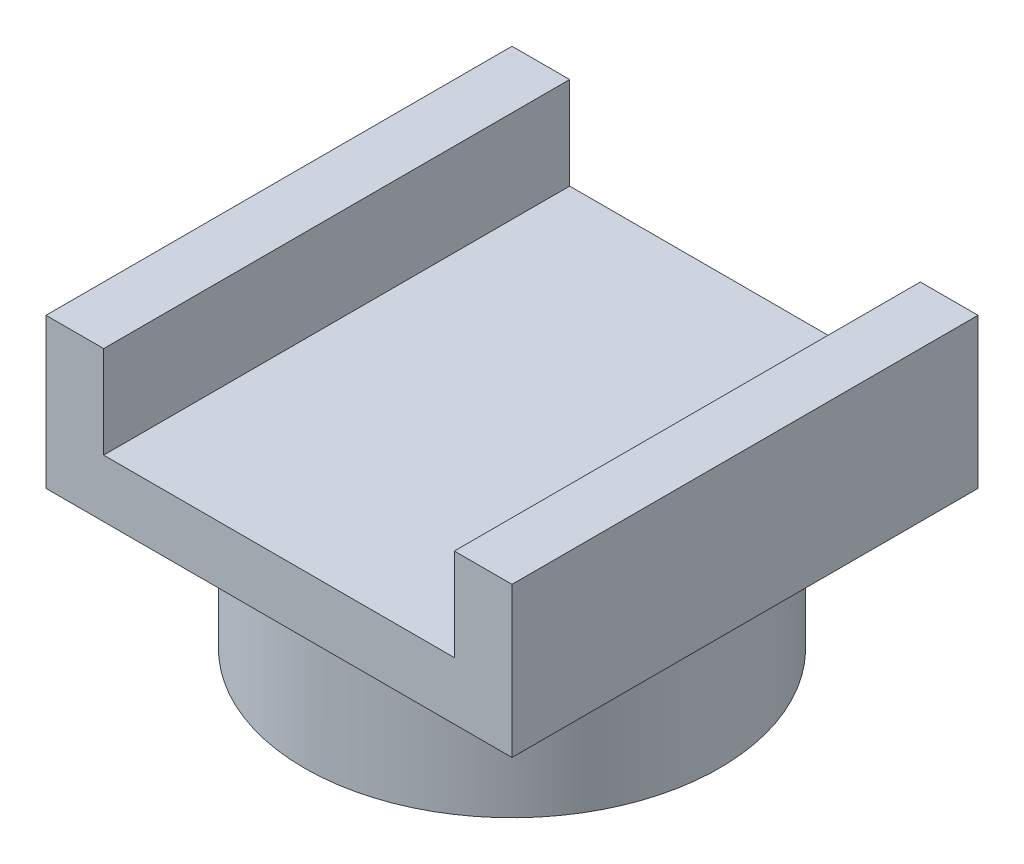
from build123d import *

# Parameters (mm, degrees)
SKETCH1_R           = 0.5
SKETCH1_R_2         = 1.375
BOSS_EXTRUDE1_DEPTH = 2
SKETCH4_R           = 4.5
SKETCH4_R_2         = 2.5
BOSS_EXTRUDE3_DEPTH = 3
CUT_EXTRUDE3_START  = -3
CUT_EXTRUDE3_DEPTH  = 3
SKETCH6_W           = 34.029642768
SKETCH6_H           = 33.796563024
CUT_EXTRUDE4_DEPTH  = 22.43595111
SKETCH7_W           = 10.1
SKETCH7_H           = 10.1
BOSS_EXTRUDE4_DEPTH = 1.25
SKETCH8_W           = 1.25
SKETCH8_H           = 10.1
BOSS_EXTRUDE5_DEPTH = 2


with BuildPart() as part:
    # Sketch1 → Boss-Extrude1 (new body)
    with BuildSketch(Plane(origin=(0, 0, 0), x_dir=(1, 0, 0), z_dir=(0, 1, 0))):
        with BuildLine():
            Line((-4, 4), (-2.467435953, 13.402193757))
            ThreePointArc((-2.467435953, 13.402193757), (0, 15.5), (2.467435953, 13.402193757))
            Line((2.467435953, 13.402193757), (4, 4))
            Line((4, 4), (12.448472752, 2.459445505))
            ThreePointArc((12.448472752, 2.459445505), (14.5, 0), (12.448472752, -2.459445505))
            Line((12.448472752, -2.459445505), (4, -4))
            Line((4, -4), (2.467435953, -13.402193757))
            ThreePointArc((2.467435953, -13.402193757), (0, -15.5), (-2.467435953, -13.402193757))
            Line((-2.467435953, -13.402193757), (-4, -4))
            Line((-4, -4), (-12.448472752, -2.459445505))
            ThreePointArc((-12.448472752, -2.459445505), (-14.5, 0), (-12.448472752, 2.459445505))
            Line((-12.448472752, 2.459445505), (-4, 4))
        make_face()
        with Locations(Location((0, 12, 0), (0, 0, 270))):
            Circle(SKETCH1_R, mode=Mode.SUBTRACT)
        with Locations(Location((0, 9.5, 0), (0, 0, 270))):
            Circle(SKETCH1_R, mode=Mode.SUBTRACT)
        with Locations(Location((0, 7.5, 0), (0, 0, 270))):
            Circle(SKETCH1_R, mode=Mode.SUBTRACT)
        with Locations(Location((12, 0, 0), (0, 0, 270))):
            Circle(SKETCH1_R, mode=Mode.SUBTRACT)
        with Locations(Location((9.5, 0, 0), (0, 0, 270))):
            Circle(SKETCH1_R, mode=Mode.SUBTRACT)
        with Locations(Location((7.5, 0, 0), (0, 0, 270))):
            Circle(SKETCH1_R, mode=Mode.SUBTRACT)
        with Locations(Location((0, -12, 0), (0, 0, 270))):
            Circle(SKETCH1_R, mode=Mode.SUBTRACT)
        with Locations(Location((0, -9.5, 0), (0, 0, 270))):
            Circle(SKETCH1_R, mode=Mode.SUBTRACT)
        with Locations(Location((0, -7.5, 0), (0, 0, 270))):
            Circle(SKETCH1_R, mode=Mode.SUBTRACT)
        with Locations(Location((-12, 0, 0), (0, 0, 270))):
            Circle(SKETCH1_R, mode=Mode.SUBTRACT)
        with Locations(Location((-9.5, 0, 0), (0, 0, 270))):
            Circle(SKETCH1_R, mode=Mode.SUBTRACT)
        with Locations(Location((-7.5, 0, 0), (0, 0, 270))):
            Circle(SKETCH1_R, mode=Mode.SUBTRACT)
        with Locations(Location((0, 0, 0), (0, 0, 270))):
            Circle(SKETCH1_R_2, mode=Mode.SUBTRACT)
    extrude(amount=BOSS_EXTRUDE1_DEPTH)

    # Sketch4 → Boss-Extrude3 (add)
    with BuildSketch(Plane.XZ):
        with Locations(Location((0, 0, 0), (0, 0, 90))):
            Circle(SKETCH4_R)
        with Locations(Location((0, 0, 0), (0, 0, 270))):
            Circle(SKETCH4_R_2, mode=Mode.SUBTRACT)
    extrude(amount=BOSS_EXTRUDE3_DEPTH)

    # Sketch5 → Cut-Extrude3 (cut)
    with BuildSketch(Plane.XZ.offset(3).offset(CUT_EXTRUDE3_START)):
        with BuildLine():
            Line((0.299038106, 2.482050808), (0, 3))
            Line((0, 3), (-0.299038106, 2.482050808))
            ThreePointArc((-0.299038106, 2.482050808), (-0.391086163, 2.469220851), (-0.482593741, 2.452978451))
            Line((-0.482593741, 2.452978451), (-0.927050983, 2.853169549))
            Line((-0.927050983, 2.853169549), (-1.051398019, 2.268162738))
            ThreePointArc((-1.051398019, 2.268162738), (-1.134976249, 2.22751631), (-1.216985951, 2.183791473))
            Line((-1.216985951, 2.183791473), (-1.763355757, 2.427050983))
            Line((-1.763355757, 2.427050983), (-1.70083977, 1.832251096))
            ThreePointArc((-1.70083977, 1.832251096), (-1.767766953, 1.767766953), (-1.832251096, 1.70083977))
            Line((-1.832251096, 1.70083977), (-2.427050983, 1.763355757))
            Line((-2.427050983, 1.763355757), (-2.183791473, 1.216985951))
            ThreePointArc((-2.183791473, 1.216985951), (-2.22751631, 1.134976249), (-2.268162738, 1.051398019))
            Line((-2.268162738, 1.051398019), (-2.853169549, 0.927050983))
            Line((-2.853169549, 0.927050983), (-2.452978451, 0.482593741))
            ThreePointArc((-2.452978451, 0.482593741), (-2.469220851, 0.391086163), (-2.482050808, 0.299038106))
            Line((-2.482050808, 0.299038106), (-3, 0))
            Line((-3, 0), (-2.482050808, -0.299038106))
            ThreePointArc((-2.482050808, -0.299038106), (-2.469220851, -0.391086163), (-2.452978451, -0.482593741))
            Line((-2.452978451, -0.482593741), (-2.853169549, -0.927050983))
            Line((-2.853169549, -0.927050983), (-2.268162738, -1.051398019))
            ThreePointArc((-2.268162738, -1.051398019), (-2.22751631, -1.134976249), (-2.183791473, -1.216985951))
            Line((-2.183791473, -1.216985951), (-2.427050983, -1.763355757))
            Line((-2.427050983, -1.763355757), (-1.832251096, -1.70083977))
            ThreePointArc((-1.832251096, -1.70083977), (-1.767766953, -1.767766953), (-1.70083977, -1.832251096))
            Line((-1.70083977, -1.832251096), (-1.763355757, -2.427050983))
            Line((-1.763355757, -2.427050983), (-1.216985951, -2.183791473))
            ThreePointArc((-1.216985951, -2.183791473), (-1.134976249, -2.22751631), (-1.051398019, -2.268162738))
            Line((-1.051398019, -2.268162738), (-0.927050983, -2.853169549))
            Line((-0.927050983, -2.853169549), (-0.482593741, -2.452978451))
            ThreePointArc((-0.482593741, -2.452978451), (-0.391086163, -2.469220851), (-0.299038106, -2.482050808))
            Line((-0.299038106, -2.482050808), (0, -3))
            Line((0, -3), (0.299038106, -2.482050808))
            ThreePointArc((0.299038106, -2.482050808), (0.391086163, -2.469220851), (0.482593741, -2.452978451))
            Line((0.482593741, -2.452978451), (0.927050983, -2.853169549))
            Line((0.927050983, -2.853169549), (1.051398019, -2.268162738))
            ThreePointArc((1.051398019, -2.268162738), (1.134976249, -2.22751631), (1.216985951, -2.183791473))
            Line((1.216985951, -2.183791473), (1.763355757, -2.427050983))
            Line((1.763355757, -2.427050983), (1.70083977, -1.832251096))
            ThreePointArc((1.70083977, -1.832251096), (1.767766953, -1.767766953), (1.832251096, -1.70083977))
            Line((1.832251096, -1.70083977), (2.427050983, -1.763355757))
            Line((2.427050983, -1.763355757), (2.183791473, -1.216985951))
            ThreePointArc((2.183791473, -1.216985951), (2.22751631, -1.134976249), (2.268162738, -1.051398019))
            Line((2.268162738, -1.051398019), (2.853169549, -0.927050983))
            Line((2.853169549, -0.927050983), (2.452978451, -0.482593741))
            ThreePointArc((2.452978451, -0.482593741), (2.469220851, -0.391086163), (2.482050808, -0.299038106))
            Line((2.482050808, -0.299038106), (3, 0))
            Line((3, 0), (2.482050808, 0.299038106))
            ThreePointArc((2.482050808, 0.299038106), (2.469220851, 0.391086163), (2.452978451, 0.482593741))
            Line((2.452978451, 0.482593741), (2.853169549, 0.927050983))
            Line((2.853169549, 0.927050983), (2.268162738, 1.051398019))
            ThreePointArc((2.268162738, 1.051398019), (2.22751631, 1.134976249), (2.183791473, 1.216985951))
            Line((2.183791473, 1.216985951), (2.427050983, 1.763355757))
            Line((2.427050983, 1.763355757), (1.832251096, 1.70083977))
            ThreePointArc((1.832251096, 1.70083977), (1.767766953, 1.767766953), (1.70083977, 1.832251096))
            Line((1.70083977, 1.832251096), (1.763355757, 2.427050983))
            Line((1.763355757, 2.427050983), (1.216985951, 2.183791473))
            ThreePointArc((1.216985951, 2.183791473), (1.134976249, 2.22751631), (1.051398019, 2.268162738))
            Line((1.051398019, 2.268162738), (0.927050983, 2.853169549))
            Line((0.927050983, 2.853169549), (0.482593741, 2.452978451))
            ThreePointArc((0.482593741, 2.452978451), (0.391086163, 2.469220851), (0.299038106, 2.482050808))
        make_face()
    extrude(amount=CUT_EXTRUDE3_DEPTH, mode=Mode.SUBTRACT)

    # Sketch6 → Cut-Extrude4 (cut, through all)
    with BuildSketch(Plane(origin=(0, 0, 0), x_dir=(-1, 0, 0), z_dir=(0, -1, 0))):
        Rectangle(SKETCH6_W, SKETCH6_H)
    extrude(amount=-CUT_EXTRUDE4_DEPTH, mode=Mode.SUBTRACT)

    # Sketch7 → Boss-Extrude4 (add)
    with BuildSketch(Plane(origin=(0, 0, 0), x_dir=(1, 0, 0), z_dir=(0, 1, 0))):
        Rectangle(SKETCH7_W, SKETCH7_H)
    extrude(amount=BOSS_EXTRUDE4_DEPTH)

    # Sketch8 → Boss-Extrude5 (add)
    with BuildSketch(Plane(origin=(0, 1.25, 0), x_dir=(1, 0, 0), z_dir=(0, 1, 0))):
        with Locations((-4.425, 0)):
            Rectangle(SKETCH8_W, SKETCH8_H)
        with Locations((4.425, 0)):
            Rectangle(SKETCH8_W, SKETCH8_H)
    extrude(amount=BOSS_EXTRUDE5_DEPTH)


solid = part.part
